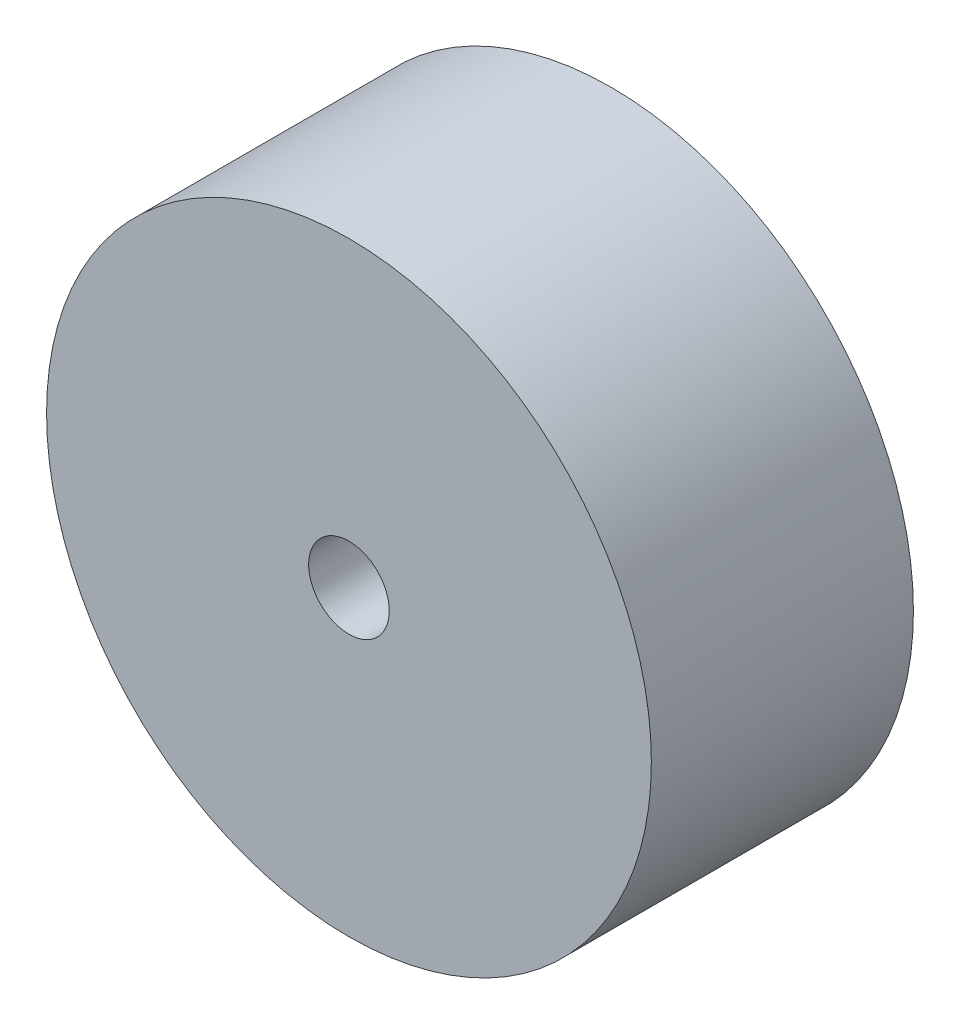
from build123d import *

# Parameters (mm, degrees)
SKETCH1_R           = 30
BOSS_EXTRUDE1_DEPTH = 26
SKETCH2_R           = 4
CUT_EXTRUDE1_DEPTH  = 10


with BuildPart() as part:
    # Sketch1 → Boss-Extrude1 (new body)
    with BuildSketch(Plane.XY):
        with Locations(Location((0, 0, 0), (0, 0, 180))):
            Circle(SKETCH1_R)
    extrude(amount=BOSS_EXTRUDE1_DEPTH)

    # Sketch2 → Cut-Extrude1 (cut)
    with BuildSketch(Plane.XY.offset(26)):
        Circle(SKETCH2_R)
    extrude(amount=-CUT_EXTRUDE1_DEPTH, mode=Mode.SUBTRACT)


solid = part.part
